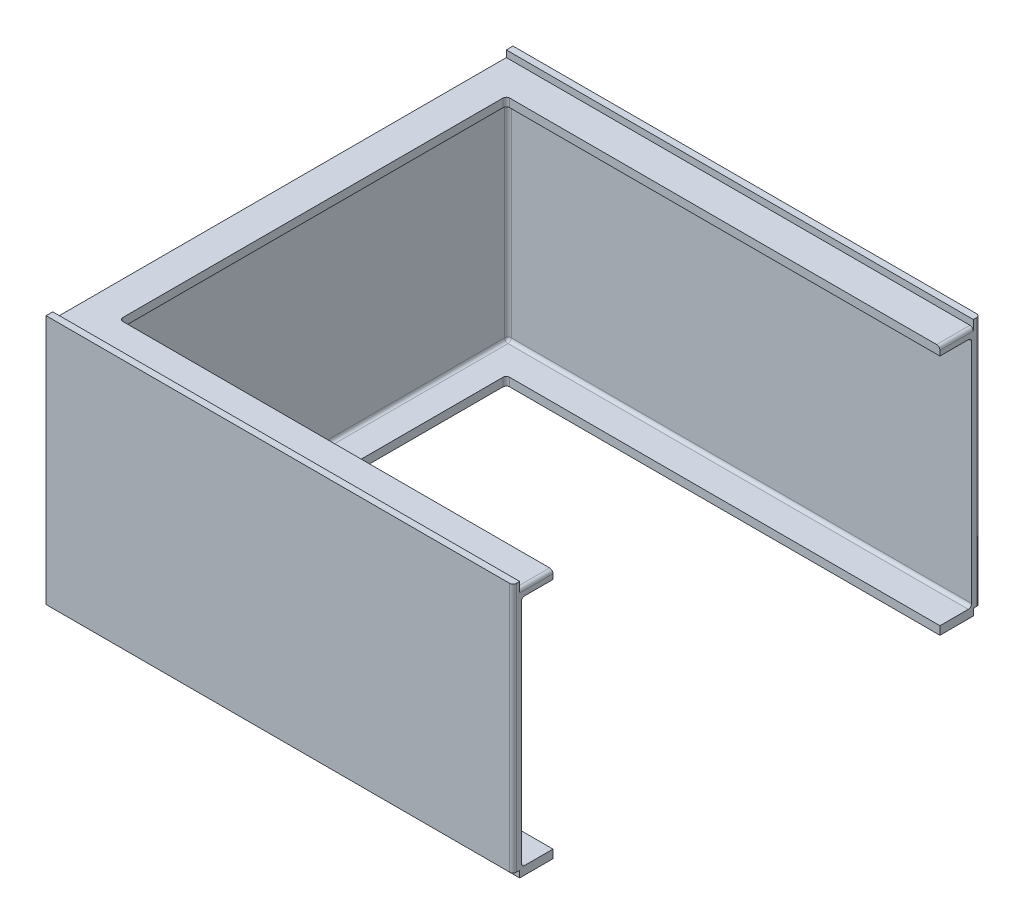
from build123d import *

# Parameters (mm, degrees)
SKETCH_1_W          = 280
SKETCH_1_H          = 280
EXTRUDE_1_DEPTH     = 154
SKETCH_2_W          = 280
SKETCH_2_H          = 272
CUT_EXTRUDE_1_DEPTH = 4
SKETCH_3_W          = 280
SKETCH_3_H          = 4
CUT_EXTRUDE_2_DEPTH = 4
SKETCH_4_W          = 270
SKETCH_4_H          = 140
CUT_EXTRUDE_3_DEPTH = 278
SKETCH_6_W          = 260
SKETCH_6_H          = 232
CUT_EXTRUDE_7_DEPTH = 249.394846967
FILLET_4_R          = 2
FILLET_5_R          = 2
FILLET_6_R          = 2
FILLET_7_R          = 2


with BuildPart() as part:
    # 草图1 → 凸台-拉伸1 (new body)
    with BuildSketch(Plane(origin=(0, 0, 0), x_dir=(1, 0, 0), z_dir=(0, 1, 0))):
        Rectangle(SKETCH_1_W, SKETCH_1_H)
    extrude(amount=EXTRUDE_1_DEPTH)

    # 草图2 → 切除-拉伸1 (cut)
    with BuildSketch(Plane(origin=(0, 154, 0), x_dir=(1, 0, 0), z_dir=(0, 1, 0))):
        Rectangle(SKETCH_2_W, SKETCH_2_H)
    extrude(amount=-CUT_EXTRUDE_1_DEPTH, mode=Mode.SUBTRACT)

    # 草图3 → 切除-拉伸2 (cut)
    with BuildSketch(Plane.XZ):
        with Locations((0, 138)):
            Rectangle(SKETCH_3_W, SKETCH_3_H)
        with Locations((0, -138)):
            Rectangle(SKETCH_3_W, SKETCH_3_H)
    extrude(amount=-CUT_EXTRUDE_2_DEPTH, mode=Mode.SUBTRACT)

    # 草图4 → 切除-拉伸3 (cut)
    with BuildSketch(Plane(origin=(140, 0, 0), x_dir=(0, 0, -1), z_dir=(1, 0, 0))):
        with Locations((0, 75)):
            Rectangle(SKETCH_4_W, SKETCH_4_H)
    extrude(amount=-CUT_EXTRUDE_3_DEPTH, mode=Mode.SUBTRACT)

    # 草图6 → 切除-拉伸7 (cut, through all)
    with BuildSketch(Plane(origin=(0, 150, 0), x_dir=(1, 0, 0), z_dir=(0, 1, 0))):
        with Locations((10, 0)):
            Rectangle(SKETCH_6_W, SKETCH_6_H)
    extrude(amount=-CUT_EXTRUDE_7_DEPTH, mode=Mode.SUBTRACT)

    # 圆角4
    fillet_4_edges = [part.edges().sort_by_distance(p)[0] for p in [
        (140, 79, -140),
        (140, 79, 140),
    ]]
    fillet(fillet_4_edges, radius=FILLET_4_R)

    # 圆角5
    fillet_5_edges = [part.edges().sort_by_distance(p)[0] for p in [
        (140, 150, 126),
        (140, 150, -126),
    ]]
    fillet(fillet_5_edges, radius=FILLET_5_R)

    # 圆角6
    fillet_6_edges = [part.edges().sort_by_distance(p)[0] for p in [
        (-120, 147.5, 116),
        (-120, 2.5, 116),
        (-120, 147.5, -116),
        (-120, 2.5, -116),
    ]]
    fillet(fillet_6_edges, radius=FILLET_6_R)

    # 圆角7
    fillet_7_edges = [part.edges().sort_by_distance(p)[0] for p in [
        (1, 5, 135),
        (1, 145, 135),
        (1, 145, -135),
        (1, 5, -135),
        (-138, 75, 135),
        (-138, 145, 0),
        (-138, 75, -135),
        (-138, 5, 0),
    ]]
    fillet(fillet_7_edges, radius=FILLET_7_R)


solid = part.part
